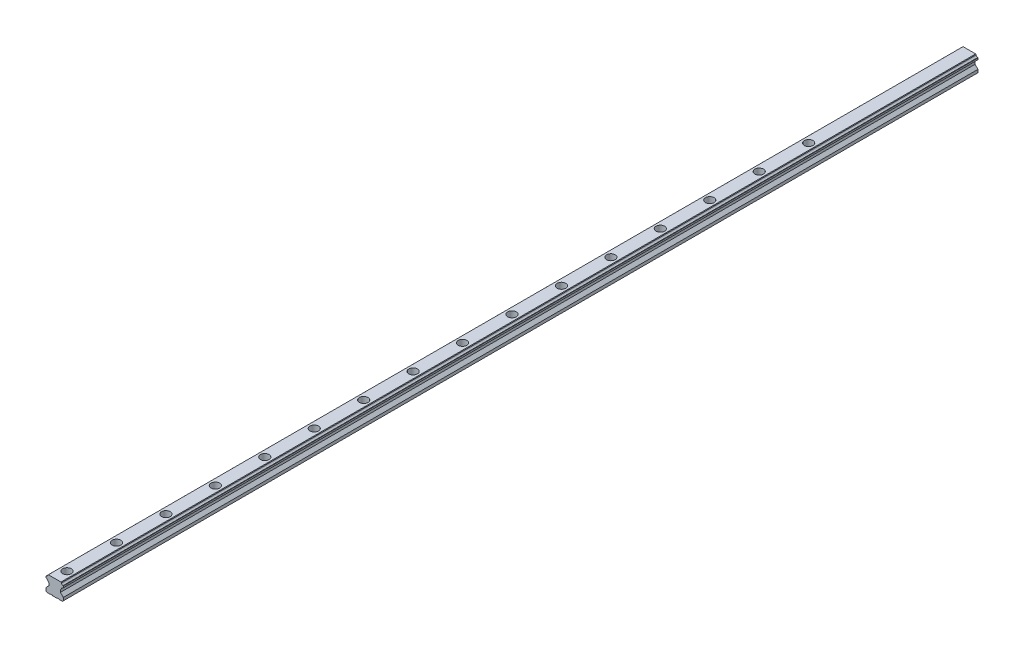
from build123d import *

# Parameters (mm, degrees)
EXTRUDE1_DEPTH  = 1480
LPATTERN1_COUNT = 16
LPATTERN1_PITCH = 80


with BuildPart() as part:
    # Sketch1 → Extrude1 (new body)
    with BuildSketch(Plane(origin=(-20, 0, 0), x_dir=(1, 0, 0), z_dir=(0, 0, 1))):
        with BuildLine():
            Line((6, 22.215003013), (6, 19.779148101))
            Line((6, 19.779148101), (6.469129189, 19.31001796))
            ThreePointArc((6.469129189, 19.31001796), (8.17390926, 18.483479572), (9.000447648, 16.7786995))
            Line((9.000447648, 16.7786995), (10.699707031, 15.079440117))
            Line((10.699707031, 15.079440117), (10.699707031, 10.999628067))
            Line((10.699707031, 10.999628067), (6, 6.3))
            Line((6, 6.3), (6, 1.5))
            Line((6, 1.5), (7.5, 0))
            Line((7.5, 0), (12.25, 0))
            Line((12.25, 0), (12.75, 0.5))
            Line((12.75, 0.5), (16.25, 0.5))
            Line((16.25, 0.5), (16.75, 0))
            Line((16.75, 0), (23.25, 0))
            Line((23.25, 0), (23.75, 0.5))
            Line((23.75, 0.5), (27.25, 0.5))
            Line((27.25, 0.5), (27.75, 0))
            Line((27.75, 0), (32.5, 0))
            Line((32.5, 0), (34, 1.5))
            Line((34, 1.5), (34, 6.3))
            Line((34, 6.3), (29.300292969, 10.999628067))
            Line((29.300292969, 10.999628067), (29.300292969, 15.079440117))
            Line((29.300292969, 15.079440117), (30.999552352, 16.7786995))
            ThreePointArc((30.999552352, 16.7786995), (31.82609074, 18.483479572), (33.530870811, 19.31001796))
            Line((33.530870811, 19.31001796), (34, 19.779148101))
            Line((34, 19.779148101), (34, 22.215003013))
            Line((34, 22.215003013), (33.530870811, 22.690496335))
            ThreePointArc((33.530870811, 22.690496335), (31.828109913, 23.514259322), (30.999552352, 25.214692356))
            Line((30.999552352, 25.214692356), (30.214244708, 26))
            Line((30.214244708, 26), (9.785755292, 26))
            Line((9.785755292, 26), (9.000447648, 25.214692356))
            ThreePointArc((9.000447648, 25.214692356), (8.171890087, 23.514259322), (6.469129189, 22.690496335))
            Line((6.469129189, 22.690496335), (6, 22.215003013))
        make_face()
    extrude(amount=-EXTRUDE1_DEPTH)

    # Sketch2 → Cut-Revolve1 (revolve, cut)
    with BuildSketch(Plane(origin=(0, 0, 0), x_dir=(0, 0, -1), z_dir=(1, 0, 0))):
        Polygon((20, 26), (27, 26), (27, 14), (24.5, 14), (24.5, 0), (20, 0), align=None)
    cut_revolve1 = revolve(axis=Axis((0, 0, -20), (0, 1, 0)), mode=Mode.SUBTRACT)

    # LPattern1: Cut-Revolve1 ×16
    with Locations(*[(0, 0, -i * LPATTERN1_PITCH) for i in range(1, LPATTERN1_COUNT)]):
        add(cut_revolve1, mode=Mode.SUBTRACT)


solid = part.part
